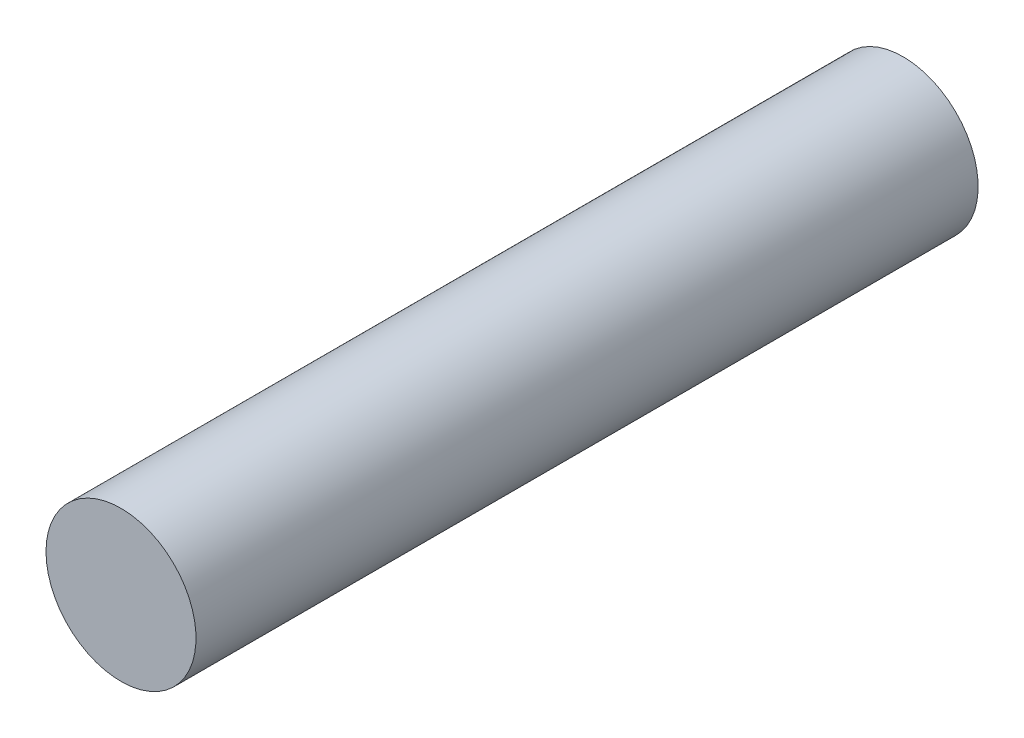
from build123d import *

# Parameters (mm, degrees)
SKETCH1_R           = 35
BOSS_EXTRUDE1_DEPTH = 365


with BuildPart() as part:
    # Sketch1 → Boss-Extrude1 (new body)
    with BuildSketch(Plane.XY):
        with Locations(Location((0, 0, 0), (0, 0, 180))):
            Circle(SKETCH1_R)
    extrude(amount=BOSS_EXTRUDE1_DEPTH)


solid = part.part
